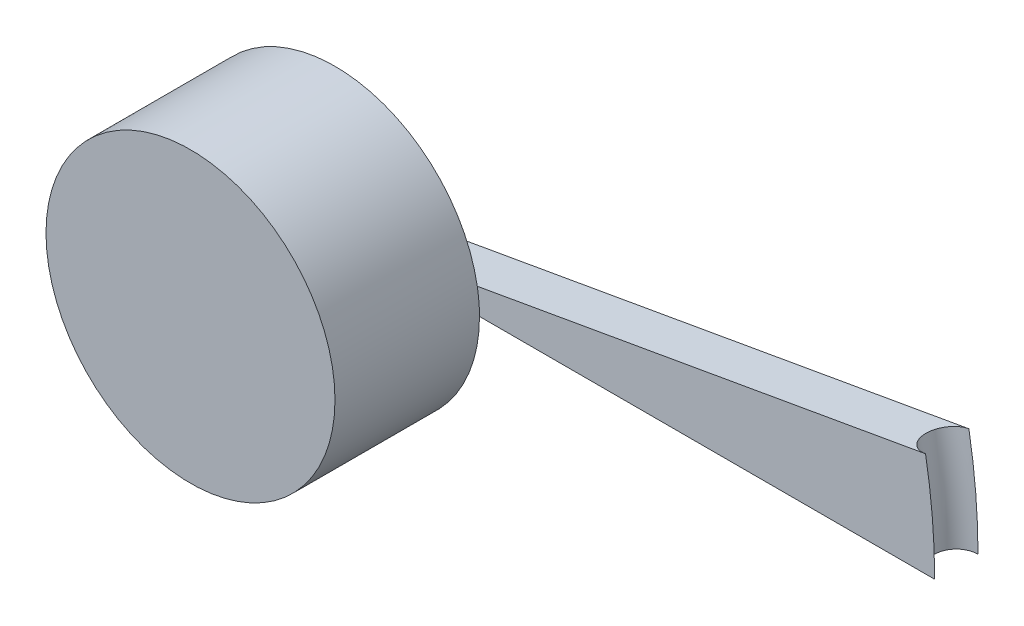
from build123d import *

# Parameters (mm, degrees)
REVOLVE2_ANGLE      = 10
SKETCH2_R           = 10
BOSS_EXTRUDE1_DEPTH = 10


with BuildPart() as part:
    # Sketch1 → Revolve2 (revolve)
    with BuildSketch(Plane(origin=(0, 0, 0), x_dir=(1, 0, 0), z_dir=(0, 1, 0))):
        with BuildLine():
            Line((40, 1.5), (41.5, 1.5))
            ThreePointArc((41.5, 1.5), (40, 0), (41.5, -1.5))
            Line((41.5, -1.5), (40, -1.5))
            Line((40, -1.5), (0, -1.5))
            Line((0, -1.5), (0, 1.5))
            Line((0, 1.5), (40, 1.5))
        make_face()
    revolve(axis=Axis((0, 0, -1.5), (0, 0, 1)), revolution_arc=REVOLVE2_ANGLE)

    # Sketch2 → Boss-Extrude1 (add)
    with BuildSketch(Plane.XY.offset(1.5)):
        Circle(SKETCH2_R)
    extrude(amount=BOSS_EXTRUDE1_DEPTH)


solid = part.part
